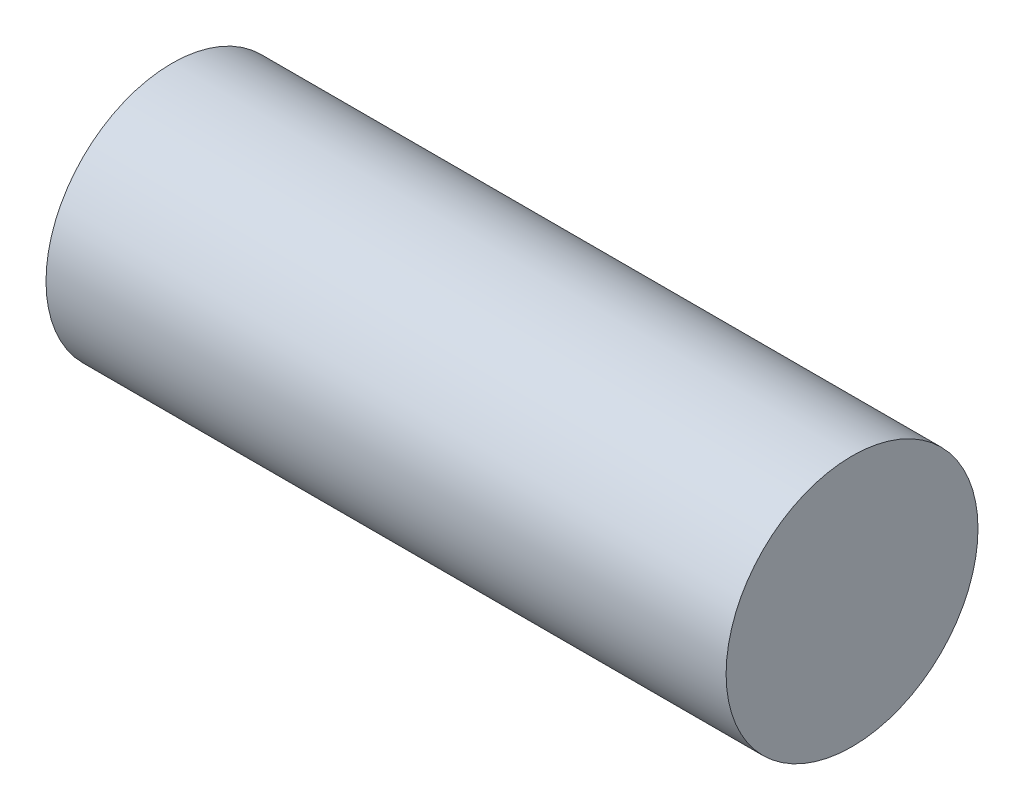
from build123d import *

# Parameters (mm, degrees)
SKETCH1_R           = 5
BOSS_EXTRUDE1_DEPTH = 27


with BuildPart() as part:
    # Sketch1 → Boss-Extrude1 (new body)
    with BuildSketch(Plane(origin=(0, 0, 0), x_dir=(0, 0, -1), z_dir=(1, 0, 0))):
        Circle(SKETCH1_R)
    extrude(amount=BOSS_EXTRUDE1_DEPTH)


solid = part.part
